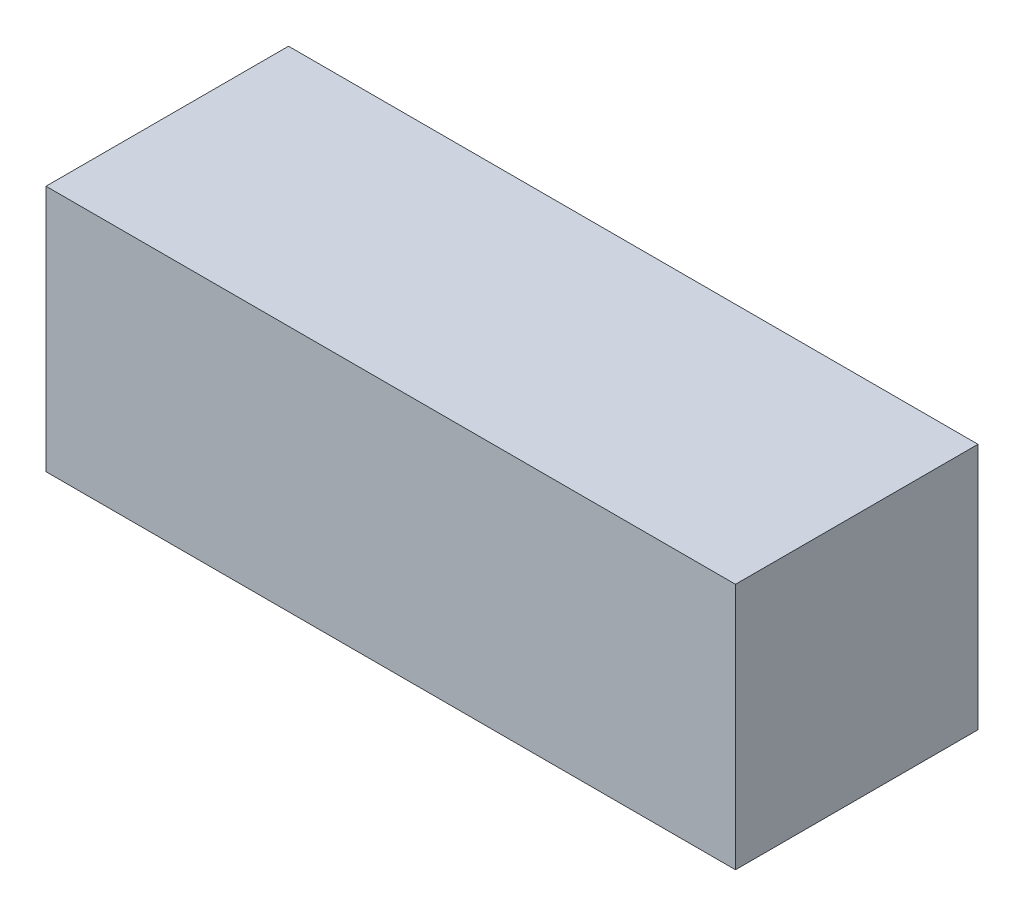
from build123d import *

# Parameters (mm, degrees)
SKETCH1_W           = 144.999964
SKETCH1_H           = 50.999898
BOSS_EXTRUDE1_DEPTH = 51.999896


with BuildPart() as part:
    # Sketch1 → Boss-Extrude1 (new body)
    with BuildSketch(Plane(origin=(0, 0, 0), x_dir=(1, 0, 0), z_dir=(0, 1, 0))):
        Rectangle(SKETCH1_W, SKETCH1_H)
    extrude(amount=BOSS_EXTRUDE1_DEPTH)


solid = part.part
